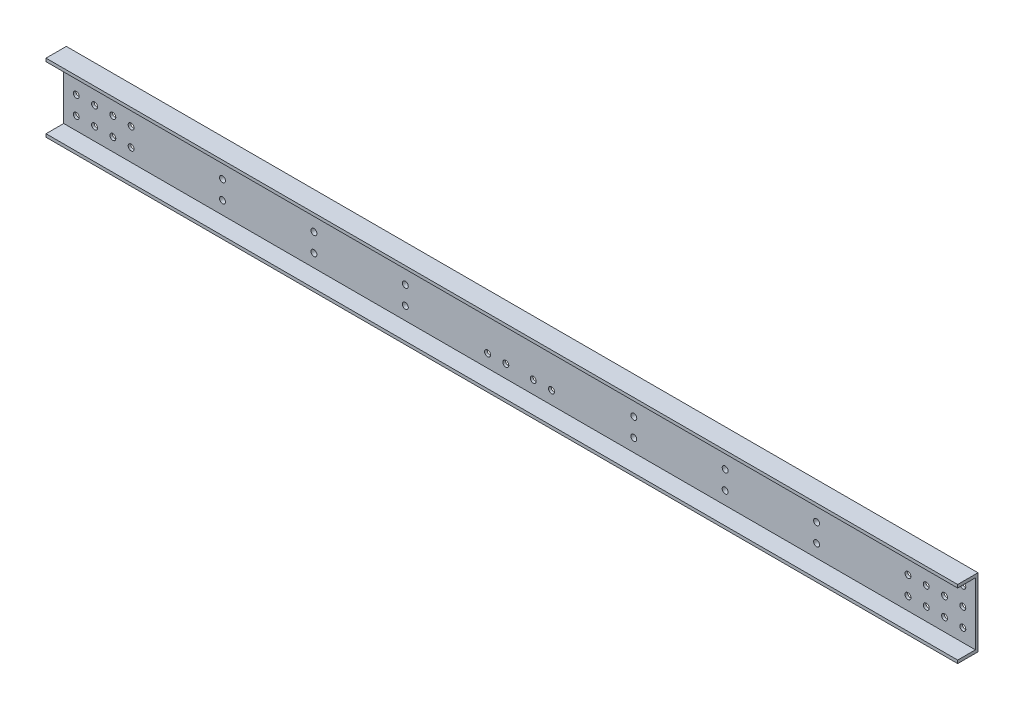
from build123d import *

# Parameters (mm, degrees)
SKETCH_1_W          = 3990
SKETCH_1_H          = 300
SKETCH_1_R          = 13
EXTRUDE_701_DEPTH   = 11.5
SKETCH_2_W          = 3990
SKETCH_2_H          = 13.5
EXTRUDE_1_DEPTH     = 77.5
SKETCH_3_W          = 70
SKETCH_3_H          = 230
EXTRUDE_2_DEPTH     = 16
SKETCH_4_R          = 13
CUT_EXTRUDE_1_DEPTH = 2004.38463606


with BuildPart() as part:
    # 草图1 → Extrude 701 (new body)
    with BuildSketch(Plane.XY):
        Rectangle(SKETCH_1_W, SKETCH_1_H)
        with Locations((1940, 0)):
            Circle(SKETCH_1_R, mode=Mode.SUBTRACT)
        with Locations((1860, 0)):
            Circle(SKETCH_1_R, mode=Mode.SUBTRACT)
        with Locations((1780, 0)):
            Circle(SKETCH_1_R, mode=Mode.SUBTRACT)
        with Locations((1700, 0)):
            Circle(SKETCH_1_R, mode=Mode.SUBTRACT)
        with Locations((1700, 80)):
            Circle(SKETCH_1_R, mode=Mode.SUBTRACT)
        with Locations((1780, 80)):
            Circle(SKETCH_1_R, mode=Mode.SUBTRACT)
        with Locations((1860, 80)):
            Circle(SKETCH_1_R, mode=Mode.SUBTRACT)
        with Locations((1940, 80)):
            Circle(SKETCH_1_R, mode=Mode.SUBTRACT)
        with Locations(Location((1940, -80, 0), (0, 0, 180))):
            Circle(SKETCH_1_R, mode=Mode.SUBTRACT)
        with Locations(Location((1860, -80, 0), (0, 0, 180))):
            Circle(SKETCH_1_R, mode=Mode.SUBTRACT)
        with Locations(Location((1780, -80, 0), (0, 0, 180))):
            Circle(SKETCH_1_R, mode=Mode.SUBTRACT)
        with Locations(Location((1700, -80, 0), (0, 0, 180))):
            Circle(SKETCH_1_R, mode=Mode.SUBTRACT)
        with Locations((-1700, -80)):
            Circle(SKETCH_1_R, mode=Mode.SUBTRACT)
        with Locations((-1780, -80)):
            Circle(SKETCH_1_R, mode=Mode.SUBTRACT)
        with Locations((-1860, -80)):
            Circle(SKETCH_1_R, mode=Mode.SUBTRACT)
        with Locations((-1940, -80)):
            Circle(SKETCH_1_R, mode=Mode.SUBTRACT)
        with Locations(Location((-1940, 80, 0), (0, 0, 180))):
            Circle(SKETCH_1_R, mode=Mode.SUBTRACT)
        with Locations(Location((-1860, 80, 0), (0, 0, 180))):
            Circle(SKETCH_1_R, mode=Mode.SUBTRACT)
        with Locations(Location((-1780, 80, 0), (0, 0, 180))):
            Circle(SKETCH_1_R, mode=Mode.SUBTRACT)
        with Locations(Location((-1700, 80, 0), (0, 0, 180))):
            Circle(SKETCH_1_R, mode=Mode.SUBTRACT)
        with Locations(Location((-1700, 0, 0), (0, 0, 180))):
            Circle(SKETCH_1_R, mode=Mode.SUBTRACT)
        with Locations(Location((-1780, 0, 0), (0, 0, 180))):
            Circle(SKETCH_1_R, mode=Mode.SUBTRACT)
        with Locations(Location((-1860, 0, 0), (0, 0, 180))):
            Circle(SKETCH_1_R, mode=Mode.SUBTRACT)
        with Locations(Location((-1940, 0, 0), (0, 0, 180))):
            Circle(SKETCH_1_R, mode=Mode.SUBTRACT)
        with Locations((60, 80)):
            Circle(SKETCH_1_R, mode=Mode.SUBTRACT)
        with Locations((140, 80)):
            Circle(SKETCH_1_R, mode=Mode.SUBTRACT)
        with Locations(Location((140, -80, 0), (0, 0, 180))):
            Circle(SKETCH_1_R, mode=Mode.SUBTRACT)
        with Locations(Location((60, -80, 0), (0, 0, 180))):
            Circle(SKETCH_1_R, mode=Mode.SUBTRACT)
        with Locations((-60, -80)):
            Circle(SKETCH_1_R, mode=Mode.SUBTRACT)
        with Locations((-140, -80)):
            Circle(SKETCH_1_R, mode=Mode.SUBTRACT)
        with Locations(Location((-140, 80, 0), (0, 0, 180))):
            Circle(SKETCH_1_R, mode=Mode.SUBTRACT)
        with Locations(Location((-60, 80, 0), (0, 0, 180))):
            Circle(SKETCH_1_R, mode=Mode.SUBTRACT)
    extrude(amount=EXTRUDE_701_DEPTH)

    # 草图2 → 凸台-拉伸1 (add)
    with BuildSketch(Plane.XY.offset(11.5)):
        with Locations((0, 143.25)):
            Rectangle(SKETCH_2_W, SKETCH_2_H)
        with Locations((0, -143.25)):
            Rectangle(SKETCH_2_W, SKETCH_2_H)
    extrude(amount=EXTRUDE_1_DEPTH)

    # 草图3 → 凸台-拉伸2 (add)
    with BuildSketch(Plane(origin=(0, 0, 0), x_dir=(-1, 0, 0), z_dir=(0, 0, -1))):
        with Locations((-1300, 0)):
            Rectangle(SKETCH_3_W, SKETCH_3_H)
        with Locations((-900, 0)):
            Rectangle(SKETCH_3_W, SKETCH_3_H)
        with Locations((-500, 0)):
            Rectangle(SKETCH_3_W, SKETCH_3_H)
        with Locations((500, 0)):
            Rectangle(SKETCH_3_W, SKETCH_3_H)
        with Locations((900, 0)):
            Rectangle(SKETCH_3_W, SKETCH_3_H)
        with Locations((1300, 0)):
            Rectangle(SKETCH_3_W, SKETCH_3_H)
    extrude(amount=EXTRUDE_2_DEPTH)

    # 草图4 → 切除-拉伸1 (cut, through all)
    with BuildSketch(Plane(origin=(0, 0, -16), x_dir=(-1, 0, 0), z_dir=(0, 0, -1))):
        with Locations((-1300, 0)):
            Circle(SKETCH_4_R)
        with Locations((-1300, 80)):
            Circle(SKETCH_4_R)
        with Locations((-900, 80)):
            Circle(SKETCH_4_R)
        with Locations((-900, 0)):
            Circle(SKETCH_4_R)
        with Locations((-500, 80)):
            Circle(SKETCH_4_R)
        with Locations((-500, 0)):
            Circle(SKETCH_4_R)
        with Locations(Location((-500, -80, 0), (0, 0, 180))):
            Circle(SKETCH_4_R)
        with Locations(Location((-900, -80, 0), (0, 0, 180))):
            Circle(SKETCH_4_R)
        with Locations(Location((-1300, -80, 0), (0, 0, 180))):
            Circle(SKETCH_4_R)
        with Locations((1300, -80)):
            Circle(SKETCH_4_R)
        with Locations((900, -80)):
            Circle(SKETCH_4_R)
        with Locations((500, -80)):
            Circle(SKETCH_4_R)
        with Locations(Location((500, 0, 0), (0, 0, 180))):
            Circle(SKETCH_4_R)
        with Locations(Location((500, 80, 0), (0, 0, 180))):
            Circle(SKETCH_4_R)
        with Locations(Location((900, 0, 0), (0, 0, 180))):
            Circle(SKETCH_4_R)
        with Locations(Location((900, 80, 0), (0, 0, 180))):
            Circle(SKETCH_4_R)
        with Locations(Location((1300, 80, 0), (0, 0, 180))):
            Circle(SKETCH_4_R)
        with Locations(Location((1300, 0, 0), (0, 0, 180))):
            Circle(SKETCH_4_R)
    extrude(amount=-CUT_EXTRUDE_1_DEPTH, mode=Mode.SUBTRACT)


solid = part.part
